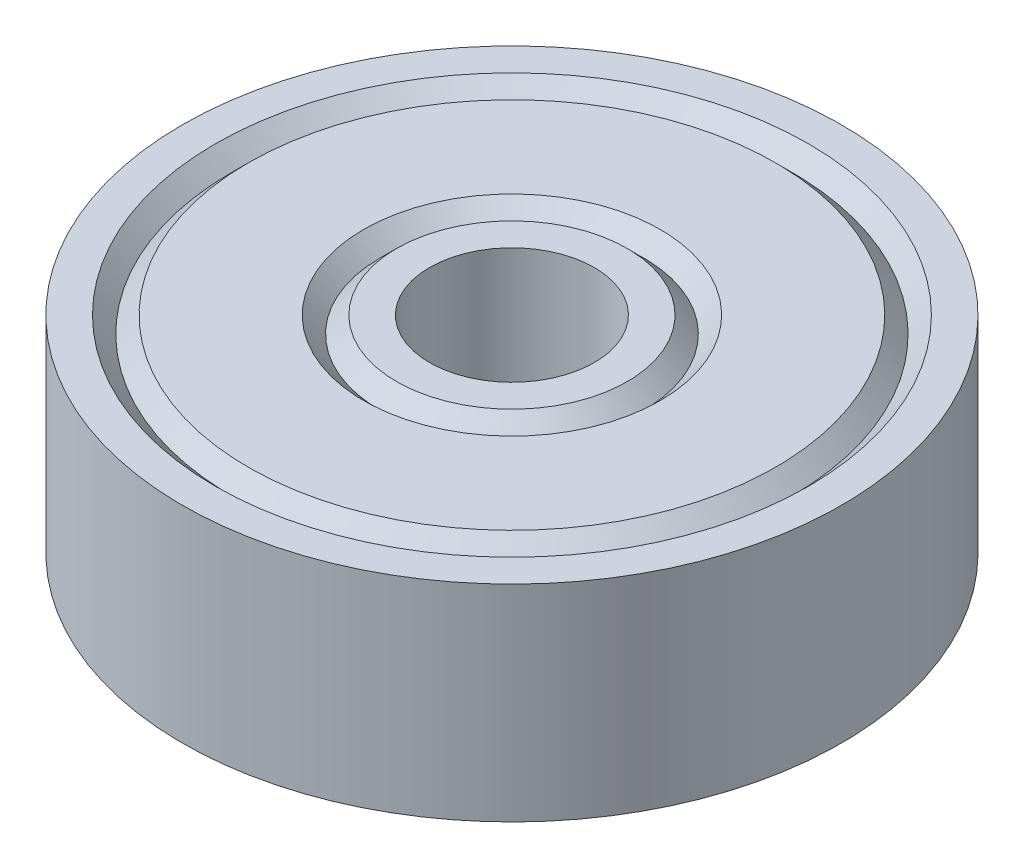
from build123d import *


with BuildPart() as part:
    # Sketch1 → Revolve1 (revolve)
    with BuildSketch(Plane.XY):
        Polygon((-2, 2.5), (-2.8, 2.5), (-3.2, 2.1), (-3.6, 2.5), (-6.4, 2.5), (-6.8, 2.1), (-7.2, 2.5), (-8, 2.5), (-8, -2.5), (-7.2, -2.5), (-6.8, -2.1), (-6.4, -2.5), (-3.6, -2.5), (-3.2, -2.1), (-2.8, -2.5), (-2, -2.5), align=None)
    revolve(axis=Axis((0, 2.5, 0), (0, -1, 0)))


solid = part.part
